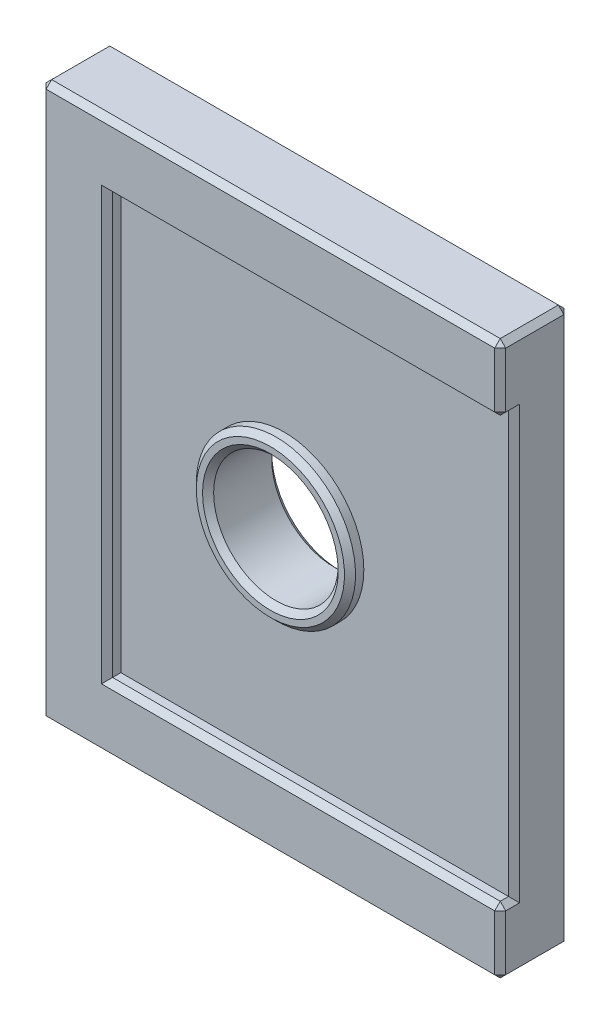
from build123d import *

# Parameters (mm, degrees)
SKETCH1_W            = 16.6
SKETCH1_H            = 20
BOSS_EXTRUDE1_DEPTH  = 2
EXTRUDE_THIN1_DEPTH  = 0.5
SKETCH3_R            = 2.875
BOSS_EXTRUDE2_DEPTH  = 0.5
M4_CLEARANCE_HOLE1_D = 4.5
DEBURS_SIZE          = 0.2


with BuildPart() as part:
    # Sketch1 → Boss-Extrude1 (new body)
    with BuildSketch(Plane.XY):
        Rectangle(SKETCH1_W, SKETCH1_H)
    extrude(amount=-BOSS_EXTRUDE1_DEPTH)

    # Sketch2 → Extrude-Thin1 (add)
    with BuildSketch(Plane.XY):
        Polygon((8.3, 10), (-8.3, 10), (-8.3, -10), (8.3, -10), (8.3, -7.6), (-5.9, -7.6), (-5.9, 7.6), (8.3, 7.6), align=None)
    extrude(amount=EXTRUDE_THIN1_DEPTH)

    # Sketch3 → Boss-Extrude2 (add)
    with BuildSketch(Plane.XY):
        with Locations(Location((0, 0, 0), (0, 0, 180))):
            Circle(SKETCH3_R)
    extrude(amount=BOSS_EXTRUDE2_DEPTH)

    # M4 Clearance Hole1 (through all)
    with Locations(Plane(origin=(0, 0, -2), x_dir=(-1, 0, 0), z_dir=(0, 0, -1))):
        with Locations((0, 0)):
            Hole(M4_CLEARANCE_HOLE1_D / 2)

    # Deburs
    deburs_edges = [part.edges().sort_by_distance(p)[0] for p in [
        (-8.3, 0, -2),
        (8.3, 0, 0),
        (8.3, -8.8, 0.5),
        (1.2, -7.6, 0.5),
        (0, -10, -2),
        (8.3, -7.6, 0.25),
        (-5.9, 0, 0.5),
        (1.2, 7.6, 0.5),
        (8.3, 8.8, 0.5),
        (8.3, 7.6, 0.25),
        (0, -10, 0.5),
        (0, 10, 0.5),
        (-8.3, 0, 0.5),
        (2.875, 0, 0.5),
        (-2.25, 0, -2),
        (-2.25, 0, 0.5),
        (8.3, 0, -2),
        (8.3, -10, -0.75),
        (-8.3, -10, -0.75),
        (-8.3, 10, -0.75),
        (8.3, 10, -0.75),
        (0, 10, -2),
    ]]
    chamfer(deburs_edges, length=DEBURS_SIZE)


solid = part.part
